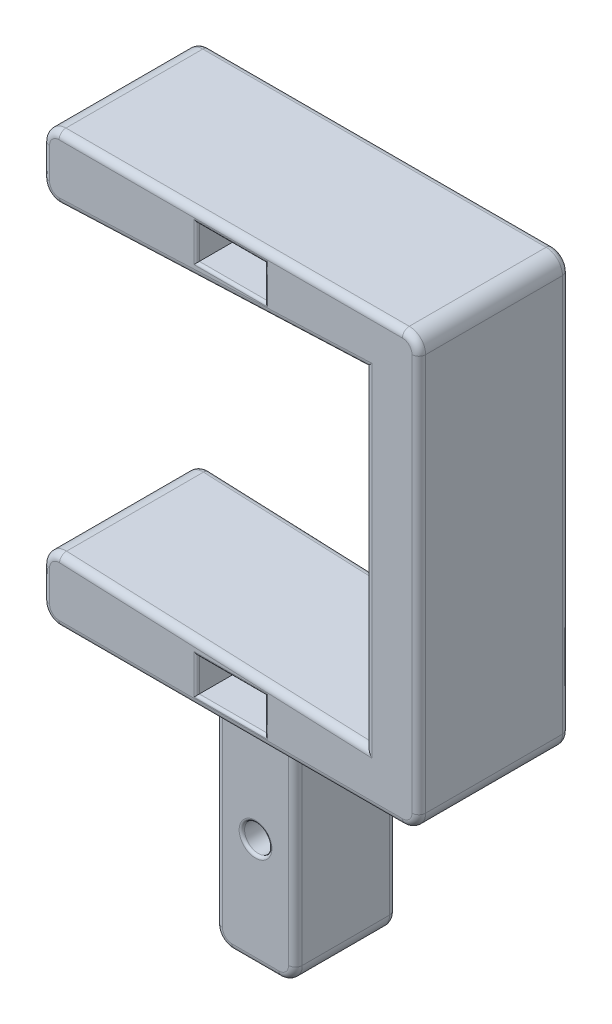
from build123d import *

# Parameters (mm, degrees)
BOSS_EXTRUDE1_DEPTH      = 7
BOSS_EXTRUDE1_DEPTH_BACK = 7
BOSS_EXTRUDE2_DEPTH      = 4.699
BOSS_EXTRUDE2_DEPTH_BACK = 4.699
SKETCH2_R                = 1.27
FILLET2_R                = 0.635
CUT_EXTRUDE1_DEPTH       = 54.609700693
CUT_EXTRUDE1_DEPTH_BACK  = 54.609700693
SKETCH3_W                = 6.35
SKETCH3_H                = 3.175
FILLET3_R                = 0.254


with BuildPart() as part:
    # Sketch1 → Boss-Extrude1 (new, two sides: drawn at the far end of the back side and taken through both)
    with BuildSketch(Plane.XY.offset(-BOSS_EXTRUDE1_DEPTH_BACK)):
        with BuildLine():
            ThreePointArc((-33.41255505, 5.93385646), (-34.530961112, 5.51101085), (-35, 4.411177657))
            Line((-35, 4.411177657), (-35, 1.524))
            ThreePointArc((-35, 1.524), (-34.553630735, 0.446369265), (-33.476, 0))
            Line((-33.476, 0), (-1.524, 0))
            ThreePointArc((-1.524, 0), (-0.446369265, 0.446369265), (0, 1.524))
            Line((0, 1.524), (0, 38.476))
            ThreePointArc((0, 38.476), (-0.446369265, 39.553630735), (-1.524, 40))
            Line((-1.524, 40), (-33.476, 40))
            ThreePointArc((-33.476, 40), (-34.553630735, 39.553630735), (-35, 38.476))
            Line((-35, 38.476), (-35, 35.588822343))
            ThreePointArc((-35, 35.588822343), (-34.530961112, 34.48898915), (-33.41255505, 34.06614354))
            Line((-33.41255505, 34.06614354), (-5, 35.25))
            Line((-5, 35.25), (-5, 4.75))
            Line((-5, 4.75), (-33.41255505, 5.93385646))
        make_face()
    extrude(amount=BOSS_EXTRUDE1_DEPTH + BOSS_EXTRUDE1_DEPTH_BACK)

    # Sketch2 → Boss-Extrude2 (add, two sides: drawn at the far end of the back side and taken through both)
    with BuildSketch(Plane.XY.offset(-BOSS_EXTRUDE2_DEPTH_BACK)):
        with BuildLine():
            Line((-21.21475, 0), (-13.78525, 0))
            Line((-13.78525, 0), (-13.78525, -18.796))
            ThreePointArc((-13.78525, -18.796), (-14.231619265, -19.873630735), (-15.30925, -20.32))
            Line((-15.30925, -20.32), (-19.69075, -20.32))
            ThreePointArc((-19.69075, -20.32), (-20.768380735, -19.873630735), (-21.21475, -18.796))
            Line((-21.21475, -18.796), (-21.21475, 0))
        make_face()
        with Locations((-17.5, -10.16)):
            Circle(SKETCH2_R, mode=Mode.SUBTRACT)
    extrude(amount=BOSS_EXTRUDE2_DEPTH + BOSS_EXTRUDE2_DEPTH_BACK)

    # Fillet2
    fillet2_edges = [part.edges().sort_by_distance(p)[0] for p in [
        (-21.21475, -9.398, -4.699),
        (-20.768380735, -19.873630735, -4.699),
        (-17.5, -20.32, -4.699),
        (-14.231619265, -19.873630735, -4.699),
        (-21.21475, -9.398, 4.699),
        (-20.768380735, -19.873630735, 4.699),
        (-17.5, -20.32, 4.699),
        (-14.231619265, -19.873630735, 4.699),
        (-19.206277525, 5.34192823, -7),
        (-34.530961112, 5.51101085, -7),
        (-35, 2.967588829, -7),
        (-34.553630735, 0.446369265, -7),
        (-17.5, 0, -7),
        (-0.446369265, 0.446369265, -7),
        (-19.206277525, 34.65807177, -7),
        (-34.530961112, 34.48898915, -7),
        (-35, 37.032411171, -7),
        (-34.553630735, 39.553630735, -7),
        (-17.5, 40, -7),
        (-0.446369265, 39.553630735, -7),
        (-19.206277525, 5.34192823, 7),
        (-34.530961112, 5.51101085, 7),
        (-35, 2.967588829, 7),
        (-34.553630735, 0.446369265, 7),
        (-17.5, 0, 7),
        (-0.446369265, 0.446369265, 7),
        (-19.206277525, 34.65807177, 7),
        (-34.530961112, 34.48898915, 7),
        (-35, 37.032411171, 7),
        (-34.553630735, 39.553630735, 7),
        (-17.5, 40, 7),
        (-0.446369265, 39.553630735, 7),
        (-5, 20, 7),
        (-5, 20, -7),
        (-13.78525, -9.398, -4.699),
        (-13.78525, -9.398, 4.699),
        (0, 20, -7),
        (0, 20, 7),
    ]]
    fillet(fillet2_edges, radius=FILLET2_R)

    # Sketch3 → Cut-Extrude1 (cut, two sides: drawn at the far end of the back side and taken through both)
    with BuildSketch(Plane.XY.offset(-CUT_EXTRUDE1_DEPTH_BACK)):
        with Locations((-17.5, 2.569270833)):
            Rectangle(SKETCH3_W, SKETCH3_H)
        with Locations((-17.5, 37.430729167)):
            Rectangle(SKETCH3_W, SKETCH3_H)
    extrude(amount=CUT_EXTRUDE1_DEPTH + CUT_EXTRUDE1_DEPTH_BACK, mode=Mode.SUBTRACT)

    # Fillet3
    fillet3_edges = [part.edges().sort_by_distance(p)[0] for p in [
        (-20.675, 2.569270833, -7),
        (-14.325, 2.569270833, -7),
        (-14.325, 2.569270833, 7),
        (-20.675, 2.569270833, 7),
        (-14.325, 37.430729167, -7),
        (-20.675, 37.430729167, -7),
        (-14.325, 37.430729167, 7),
        (-20.675, 37.430729167, 7),
        (-17.5, 0.981770833, 7),
        (-17.5, 0.981770833, -7),
        (-17.5, 4.156770833, -7),
        (-17.5, 4.156770833, 7),
        (-17.5, 35.843229167, -7),
        (-17.5, 39.018229167, -7),
        (-17.5, 39.018229167, 7),
        (-17.5, 35.843229167, 7),
        (-18.77, -10.16, 4.699),
        (-18.77, -10.16, -4.699),
    ]]
    fillet(fillet3_edges, radius=FILLET3_R)


solid = part.part
